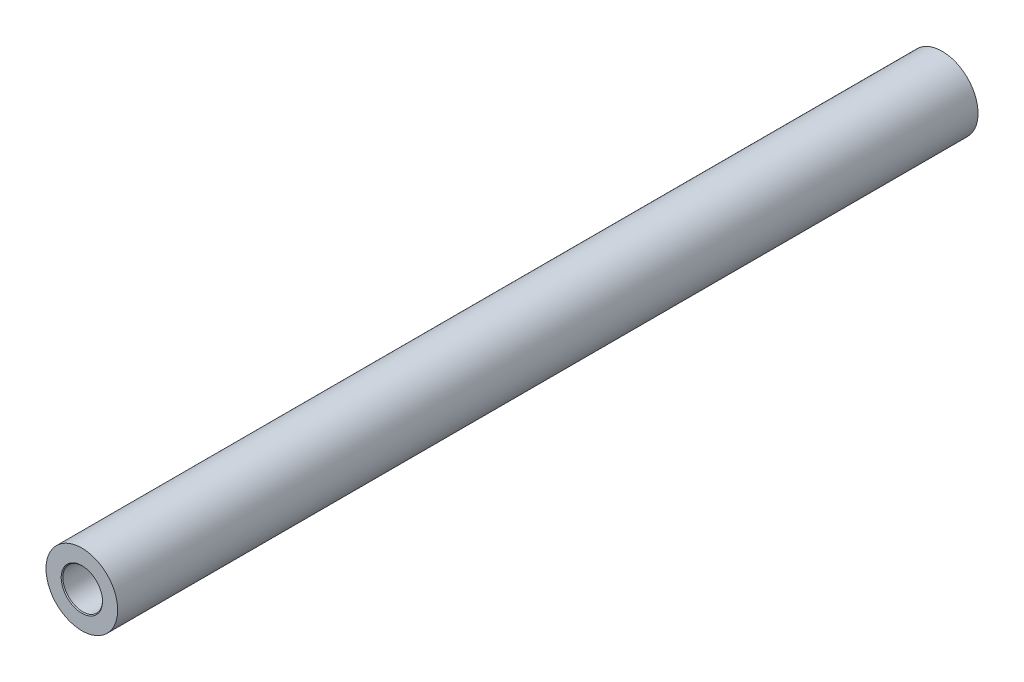
from build123d import *

# Parameters (mm, degrees)
BOSS_EXTRUDE1_START = 38.1
SKETCH13_R          = 1.7526
BOSS_EXTRUDE1_DEPTH = 9.525
CIRPATTERN1_COUNT   = 2
CIRPATTERN1_ANGLE   = 180
EXTRUDE1_DEPTH      = 38.1
EXTRUDE1_DEPTH_BACK = 38.1
SKETCH1_R           = 3.175


with BuildPart() as part:
    # Sketch13 → Boss-Extrude1 (new body)
    with BuildSketch(Plane.XY.offset(BOSS_EXTRUDE1_START)):
        Circle(SKETCH13_R)
    extrude(amount=-BOSS_EXTRUDE1_DEPTH)

    # Boss-Extrude2 cone 1 section (through the dimple's axis) → Boss-Extrude2 (revolve)
    with BuildSketch(Plane(origin=(0, 0, 38.1), x_dir=(0, -1, 0), z_dir=(1, 0, 0))):
        Polygon((0, 0), (1.8288, 0), (0, 1.8288), align=None)
    revolve(axis=Axis((0, 0, 38.1), (0, 0, -1)))


with BuildPart() as cirpattern1_1:
    # CirPattern1: pattern copy
    add(part.part.rotate(Axis((0, 3.175, 0), (0, -1, 0)), 1 * CIRPATTERN1_ANGLE / (CIRPATTERN1_COUNT - 1)))


with BuildPart() as body_3:
    # Sketch1 → Extrude1 (new, two sides: drawn at the far end of the back side and taken through both)
    with BuildSketch(Plane.XY.offset(-EXTRUDE1_DEPTH_BACK)):
        with Locations(Location((0, 0, 0), (0, 0, 180))):
            Circle(SKETCH1_R)
    extrude(amount=EXTRUDE1_DEPTH + EXTRUDE1_DEPTH_BACK)

    # Combine1: cut CirPattern1_1, part
    add(cirpattern1_1.part, mode=Mode.SUBTRACT)
    add(part.part, mode=Mode.SUBTRACT)


solid = body_3.part
